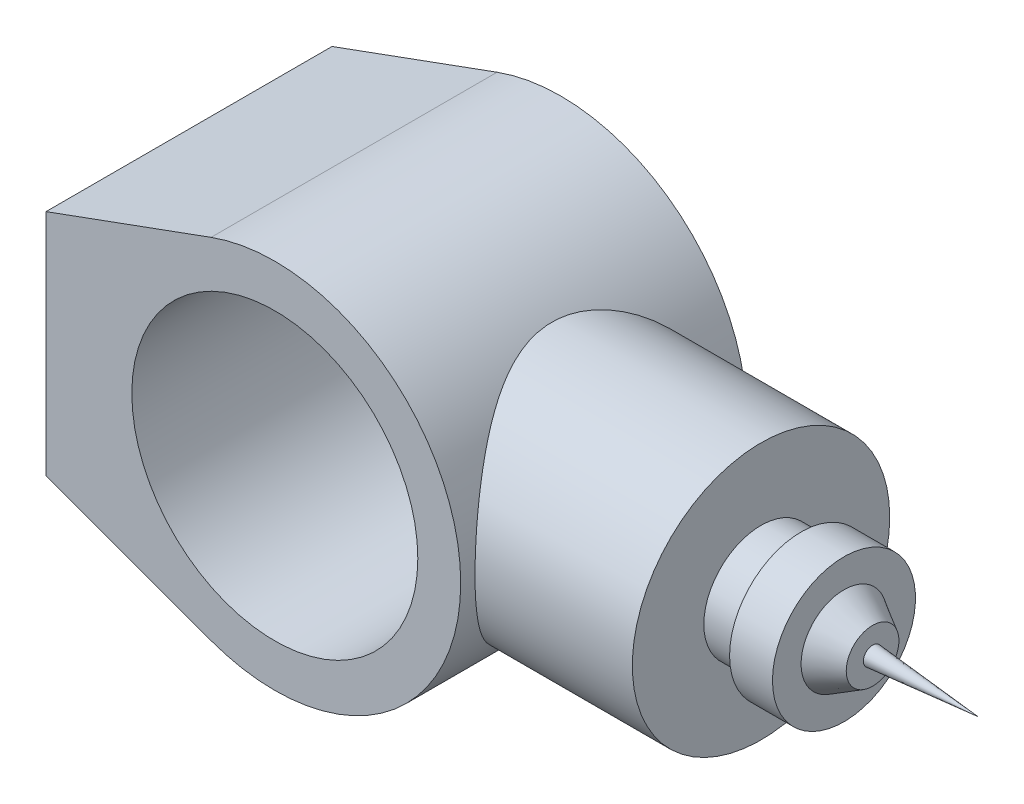
from build123d import *

# Parameters (mm, degrees)
CROQUIS1_R                   = 50
SALIENTE_EXTRUIR1_DEPTH      = 50
SALIENTE_EXTRUIR2_REACH      = 218.16
SALIENTE_EXTRUIR2_END_RADIUS = 65
CROQUIS2_R                   = 45


with BuildPart() as part:
    # Croquis1 → Saliente-Extruir1 (new, symmetric)
    with BuildSketch(Plane.XY):
        with BuildLine():
            Line((-80, -40), (-80, 40))
            Line((-80, 40), (-22.281665693, 61.061668614))
            ThreePointArc((-22.281665693, 61.061668614), (65, 0), (-22.281665693, -61.061668614))
            Line((-22.281665693, -61.061668614), (-80, -40))
        make_face()
        Circle(CROQUIS1_R, mode=Mode.SUBTRACT)
    extrude(amount=SALIENTE_EXTRUIR1_DEPTH, both=True)

    # Saliente-Extruir2: up to this cylinder (the profile starts outside it)
    saliente_extruir2_end = Plane(origin=(0, 0, 0), z_dir=(0, 0, -1)) * Cylinder(SALIENTE_EXTRUIR2_END_RADIUS, 567.32, mode=Mode.PRIVATE)
    # Croquis2 → Saliente-Extruir2 (add, up to the surface)
    with BuildSketch(Plane(origin=(120, 0, 0), x_dir=(0, 0, -1), z_dir=(1, 0, 0)), mode=Mode.PRIVATE) as saliente_extruir2_sk1:
        Circle(CROQUIS2_R)
    saliente_extruir2_tool1 = extrude(saliente_extruir2_sk1.sketch, amount=-SALIENTE_EXTRUIR2_REACH, mode=Mode.PRIVATE) - saliente_extruir2_end
    add(saliente_extruir2_tool1.solids().sort_by_distance((120, 0, 0))[0])

    # Croquis3 → Revolución1 (revolve)
    with BuildSketch(Plane.XY, mode=Mode.PRIVATE) as revoluci_n1_sk:
        Polygon((120, 0), (120, -20), (134, -20), (134, -25), (149, -25), (149, -15), (159, -9.215277891), (159, -3.215277891), (195.860032394, 0), align=None)
    revolve(revoluci_n1_sk.sketch.rotate(Axis((0, 0, 0), (1, 0, 0)), 270), axis=Axis((0, 0, 0), (1, 0, 0)))


solid = part.part
